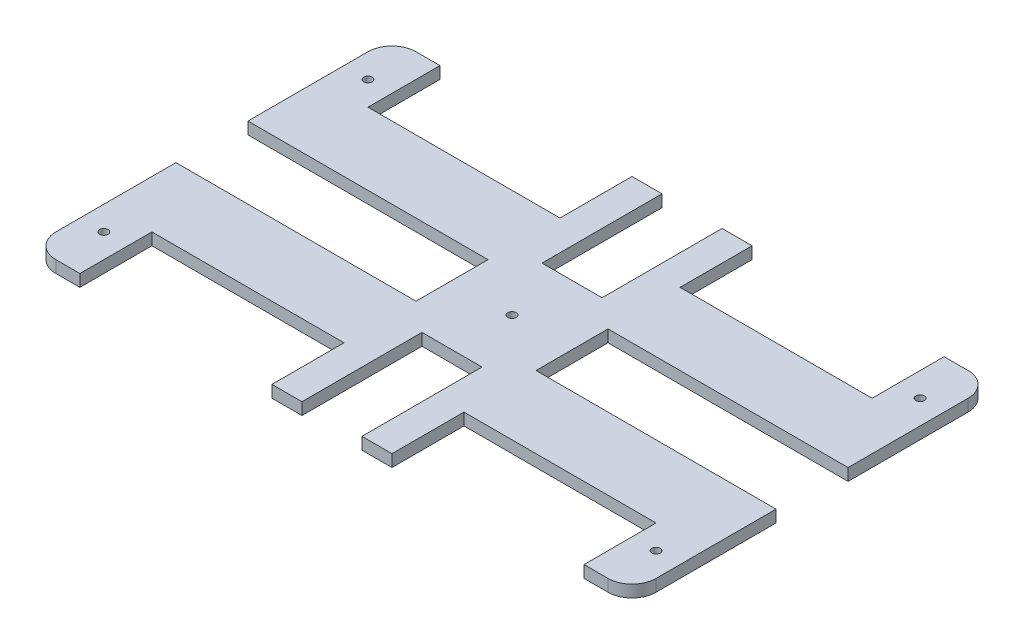
from build123d import *

# Parameters (mm, degrees)
SKETCH_1_W                                 = 250
SKETCH_1_H                                 = 150
EXTRUDE_1_DEPTH                            = 5
FILLET_1_R                                 = 10
SKETCH_2_R                                 = 1.75
CUT_EXTRUDE_1_DEPTH                        = 146.859521458
MIRROR_2_COPY_1_SKETCH_R                   = 1.75
MIRROR_2_COPY_1_DEPTH                      = 146.859521458
SKETCH_4_R                                 = 1.75
CUT_EXTRUDE_2_DEPTH                        = 5
SKETCH_5_W                                 = 25
SKETCH_5_H                                 = 50
CUT_EXTRUDE_3_DEPTH                        = 5
SKETCH_7_W                                 = 210
SKETCH_7_H                                 = 30
CUT_EXTRUDE_4_DEPTH                        = 5
SKETCH_8_W                                 = 12.5
SKETCH_8_H                                 = 30
EXTRUDE_2_DEPTH                            = 5
MIRROR_5_AT_THE_SECOND_PLANE_COPY_1_SKET_W = 12.5
MIRROR_5_AT_THE_SECOND_PLANE_COPY_1_SKET_H = 30
MIRROR_5_AT_THE_SECOND_PLANE_COPY_1_DEPTH  = 5
SKETCH_9_W                                 = 100
SKETCH_9_H                                 = 30
CUT_EXTRUDE_5_DEPTH                        = 5


with BuildPart() as part:
    # 草图1 → 凸台-拉伸1 (new body)
    with BuildSketch(Plane(origin=(0, 0, 0), x_dir=(1, 0, 0), z_dir=(0, 1, 0))):
        Rectangle(SKETCH_1_W, SKETCH_1_H)
    extrude(amount=EXTRUDE_1_DEPTH)

    # 圆角1
    fillet_1_edges = [part.edges().sort_by_distance(p)[0] for p in [
        (-125, 2.5, -75),
        (125, 2.5, -75),
        (125, 2.5, 75),
        (-125, 2.5, 75),
    ]]
    fillet(fillet_1_edges, radius=FILLET_1_R)

    # 草图2 → 切除-拉伸1 (cut, symmetric)
    with BuildSketch(Plane(origin=(0, 5, 0), x_dir=(1, 0, 0), z_dir=(0, 1, 0))):
        with Locations(Location((-115, -55, 0), (0, 0, 270))):
            Circle(SKETCH_2_R)
    cut_extrude_1 = extrude(amount=CUT_EXTRUDE_1_DEPTH, both=True, mode=Mode.SUBTRACT)

    # 镜向1: 切除-拉伸1 across plane
    add(cut_extrude_1.mirror(Plane.XY), mode=Mode.SUBTRACT)

    # 镜向2: 切除-拉伸1 across plane
    add(cut_extrude_1.mirror(Plane(origin=(0, 0, 0), x_dir=(0, 0, 1), z_dir=(1, 0, 0))), mode=Mode.SUBTRACT)

    # 镜向2 copy 1 sketch → 镜向2 copy 1 (cut, symmetric)
    with BuildSketch(Plane(origin=(0, 5, 0), x_dir=(-1, 0, 0), z_dir=(0, 1, 0))):
        with Locations(Location((-115, -55, 0), (0, 0, 270))):
            Circle(MIRROR_2_COPY_1_SKETCH_R)
    extrude(amount=MIRROR_2_COPY_1_DEPTH, both=True, mode=Mode.SUBTRACT)

    # 草图4 → 切除-拉伸2 (cut)
    with BuildSketch(Plane(origin=(0, 5, 0), x_dir=(1, 0, 0), z_dir=(0, 1, 0))):
        with Locations(Location((0, 0, 0), (0, 0, 270))):
            Circle(SKETCH_4_R)
    extrude(amount=-CUT_EXTRUDE_2_DEPTH, mode=Mode.SUBTRACT)

    # 草图5 → 切除-拉伸3 (cut)
    with BuildSketch(Plane.XZ):
        with Locations((0, 50)):
            Rectangle(SKETCH_5_W, SKETCH_5_H)
    cut_extrude_3 = extrude(amount=-CUT_EXTRUDE_3_DEPTH, mode=Mode.SUBTRACT)

    # 草图7 → 切除-拉伸4 (cut)
    with BuildSketch(Plane.XZ):
        with Locations((0, -60)):
            Rectangle(SKETCH_7_W, SKETCH_7_H)
    cut_extrude_4 = extrude(amount=-CUT_EXTRUDE_4_DEPTH, mode=Mode.SUBTRACT)

    # 镜向3: 切除-拉伸4 across plane
    add(cut_extrude_4.mirror(Plane.XY), mode=Mode.SUBTRACT)

    # 镜向4: 切除-拉伸3 across plane
    add(cut_extrude_3.mirror(Plane.XY), mode=Mode.SUBTRACT)

    # 草图8 → 凸台-拉伸2 (add)
    with BuildSketch(Plane(origin=(0, 5, 0), x_dir=(1, 0, 0), z_dir=(0, 1, 0))):
        with Locations((-18.75, -60)):
            Rectangle(SKETCH_8_W, SKETCH_8_H)
    extrude_2 = extrude(amount=-EXTRUDE_2_DEPTH)

    # 镜向5: 凸台-拉伸2 across plane
    add(extrude_2.mirror(Plane(origin=(0, 0, 0), x_dir=(0, 0, 1), z_dir=(1, 0, 0))))

    # 镜向5 at the second plane: 凸台-拉伸2 across plane
    add(extrude_2.mirror(Plane.XY))

    # 镜向5 at the second plane copy 1 sket → 镜向5 at the second plane copy 1 (add)
    with BuildSketch(Plane(origin=(0, 5, 0), x_dir=(-1, 0, 0), z_dir=(0, 1, 0))):
        with Locations((-18.75, -60)):
            Rectangle(MIRROR_5_AT_THE_SECOND_PLANE_COPY_1_SKET_W, MIRROR_5_AT_THE_SECOND_PLANE_COPY_1_SKET_H)
    extrude(amount=-MIRROR_5_AT_THE_SECOND_PLANE_COPY_1_DEPTH)

    # 草图9 → 切除-拉伸5 (cut)
    with BuildSketch(Plane(origin=(0, 5, 0), x_dir=(1, 0, 0), z_dir=(0, 1, 0))):
        with Locations((-75, 0)):
            Rectangle(SKETCH_9_W, SKETCH_9_H)
    cut_extrude_5 = extrude(amount=-CUT_EXTRUDE_5_DEPTH, mode=Mode.SUBTRACT)

    # 镜向6: 切除-拉伸5 across plane
    add(cut_extrude_5.mirror(Plane(origin=(0, 0, 0), x_dir=(0, 0, 1), z_dir=(1, 0, 0))), mode=Mode.SUBTRACT)


solid = part.part
